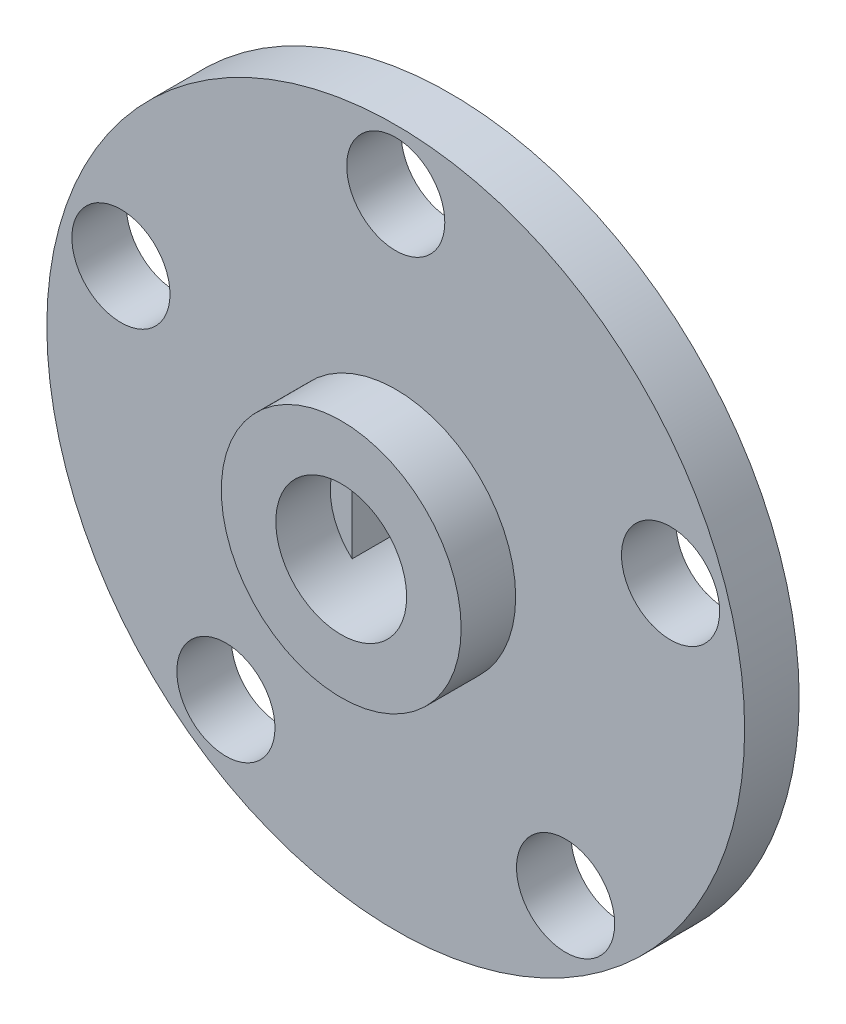
from build123d import *

# Parameters (mm, degrees)
CUT_EXTRUDE1_DEPTH = 5
SKETCH3_R          = 32
SKETCH3_R_2        = 11
CUT_EXTRUDE2_DEPTH = 5
SKETCH4_R          = 4.5
CUT_EXTRUDE3_DEPTH = 5


with BuildPart() as part:
    # Sketch1 → Revolve1 (revolve)
    with BuildSketch(Plane(origin=(0, 0, 0), x_dir=(1, 0, 0), z_dir=(0, 1, 0))):
        Polygon((4, 10), (32, 10), (32, 0), (6, 0), (6, 5), (4, 5), align=None)
    revolve(axis=Axis((0, 0, 0), (0, 0, -1)))

    # Sketch2 → Cut-Extrude1 (cut)
    with BuildSketch(Plane(origin=(0, 0, -10), x_dir=(-1, 0, 0), z_dir=(0, 0, -1))):
        with BuildLine():
            Line((-4, 4.472135955), (-4, -4.472135955))
            ThreePointArc((-4, -4.472135955), (0, -6), (4, -4.472135955))
            Line((4, -4.472135955), (4, 4.472135955))
            ThreePointArc((4, 4.472135955), (0, 6), (-4, 4.472135955))
        make_face()
    extrude(amount=-CUT_EXTRUDE1_DEPTH, mode=Mode.SUBTRACT)

    # Sketch3 → Cut-Extrude2 (cut)
    with BuildSketch(Plane.XY):
        Circle(SKETCH3_R)
        Circle(SKETCH3_R_2, mode=Mode.SUBTRACT)
    extrude(amount=-CUT_EXTRUDE2_DEPTH, mode=Mode.SUBTRACT)

    # Sketch4 → Cut-Extrude3 (cut)
    with BuildSketch(Plane.XY.offset(-5)):
        with Locations((0, 26.5)):
            Circle(SKETCH4_R)
        with Locations((25.202997682, 8.188950351)):
            Circle(SKETCH4_R)
        with Locations((15.576309186, -21.438950351)):
            Circle(SKETCH4_R)
        with Locations((-15.576309186, -21.438950351)):
            Circle(SKETCH4_R)
        with Locations((-25.202997682, 8.188950351)):
            Circle(SKETCH4_R)
    extrude(amount=-CUT_EXTRUDE3_DEPTH, mode=Mode.SUBTRACT)


solid = part.part
